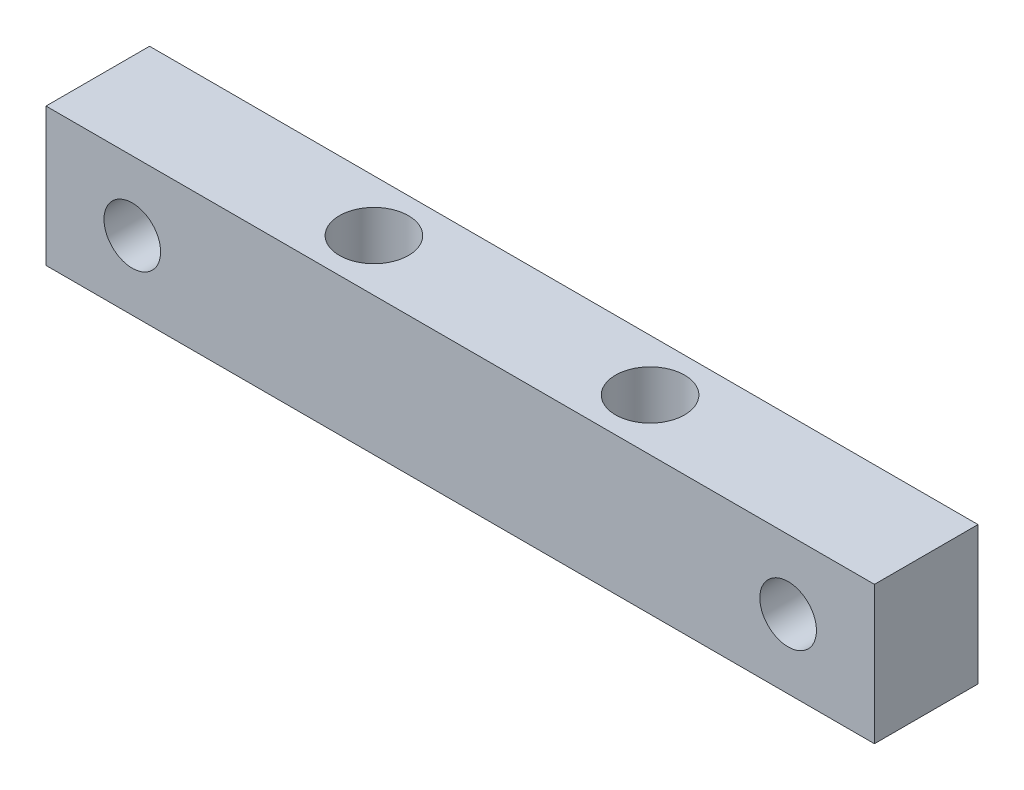
from build123d import *

# Parameters (mm, degrees)
SKETCH1_W           = 76.2
SKETCH1_H           = 9.525
SKETCH1_R           = 3.175
BOSS_EXTRUDE1_DEPTH = 12.7
CUT_EXTRUDE1_REACH  = 803.818
SKETCH2_R           = 2.6035


with BuildPart() as part:
    # Sketch1 → Boss-Extrude1 (new body)
    with BuildSketch(Plane(origin=(0, 788.156140976, 0), x_dir=(1, 0, 0), z_dir=(0, 1, 0))):
        with Locations((0, 58.7375)):
            Rectangle(SKETCH1_W, SKETCH1_H)
        with Locations(Location((-12.7, 58.7375, 0), (0, 0, 270))):
            Circle(SKETCH1_R, mode=Mode.SUBTRACT)
        with Locations(Location((12.7, 58.7375, 0), (0, 0, 90))):
            Circle(SKETCH1_R, mode=Mode.SUBTRACT)
    extrude(amount=BOSS_EXTRUDE1_DEPTH)

    # Sketch2 → Cut-Extrude1 (cut, up to next)
    with BuildSketch(Plane(origin=(0, 0, -63.5), x_dir=(-1, 0, 0), z_dir=(0, 0, -1)), mode=Mode.PRIVATE) as cut_extrude1_sk1:
        with Locations((30.1625, 794.506140976)):
            Circle(SKETCH2_R)
    cut_extrude1_tool1 = extrude(cut_extrude1_sk1.sketch, amount=-CUT_EXTRUDE1_REACH, mode=Mode.PRIVATE) & part.part
    # Sketch2 → Cut-Extrude1 (cut, up to next)
    with BuildSketch(Plane(origin=(0, 0, -63.5), x_dir=(-1, 0, 0), z_dir=(0, 0, -1)), mode=Mode.PRIVATE) as cut_extrude1_sk2:
        with Locations((-30.1625, 794.506140976)):
            Circle(SKETCH2_R)
    cut_extrude1_tool2 = extrude(cut_extrude1_sk2.sketch, amount=-CUT_EXTRUDE1_REACH, mode=Mode.PRIVATE) & part.part
    add(cut_extrude1_tool1.solids().sort_by_distance((-30.1625, 794.506141, -63.5))[0], mode=Mode.SUBTRACT)
    add(cut_extrude1_tool2.solids().sort_by_distance((30.1625, 794.506141, -63.5))[0], mode=Mode.SUBTRACT)


solid = part.part
